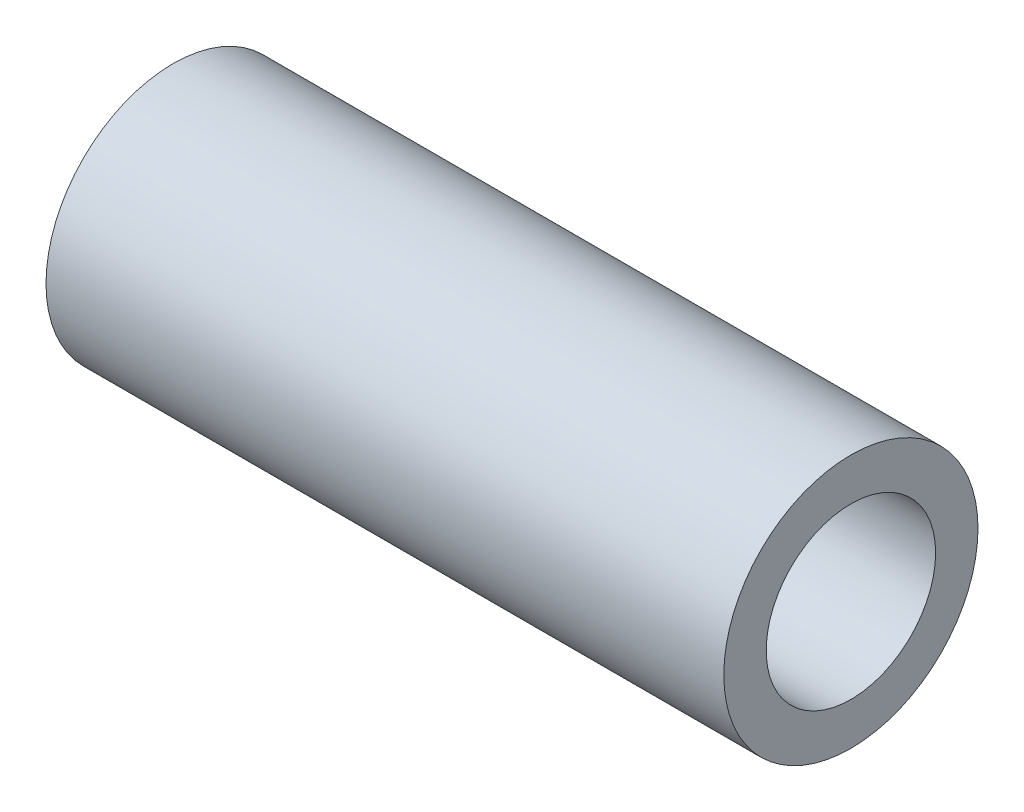
from build123d import *

# Parameters (mm, degrees)
SKETCH1_R           = 4.7625
SKETCH1_R_2         = 3.175
BOSS_EXTRUDE1_DEPTH = 25.4


with BuildPart() as part:
    # Sketch1 → Boss-Extrude1 (new body)
    with BuildSketch(Plane(origin=(0, 0, 0), x_dir=(0, 0, -1), z_dir=(1, 0, 0))):
        Circle(SKETCH1_R)
        Circle(SKETCH1_R_2, mode=Mode.SUBTRACT)
    extrude(amount=BOSS_EXTRUDE1_DEPTH)


solid = part.part
